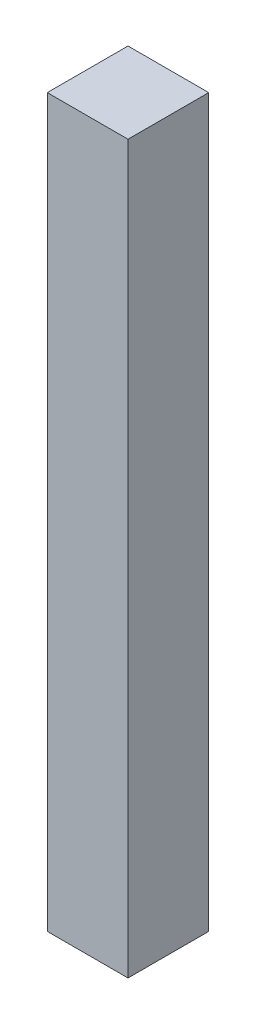
from build123d import *

# Parameters (mm, degrees)
SKETCH1_W           = 101.6
SKETCH1_H           = 101.6
BOSS_EXTRUDE1_DEPTH = 914.4


with BuildPart() as part:
    # Sketch1 → Boss-Extrude1 (new body)
    with BuildSketch(Plane(origin=(0, 0, 0), x_dir=(1, 0, 0), z_dir=(0, 1, 0))):
        Rectangle(SKETCH1_W, SKETCH1_H)
    extrude(amount=BOSS_EXTRUDE1_DEPTH)


solid = part.part
